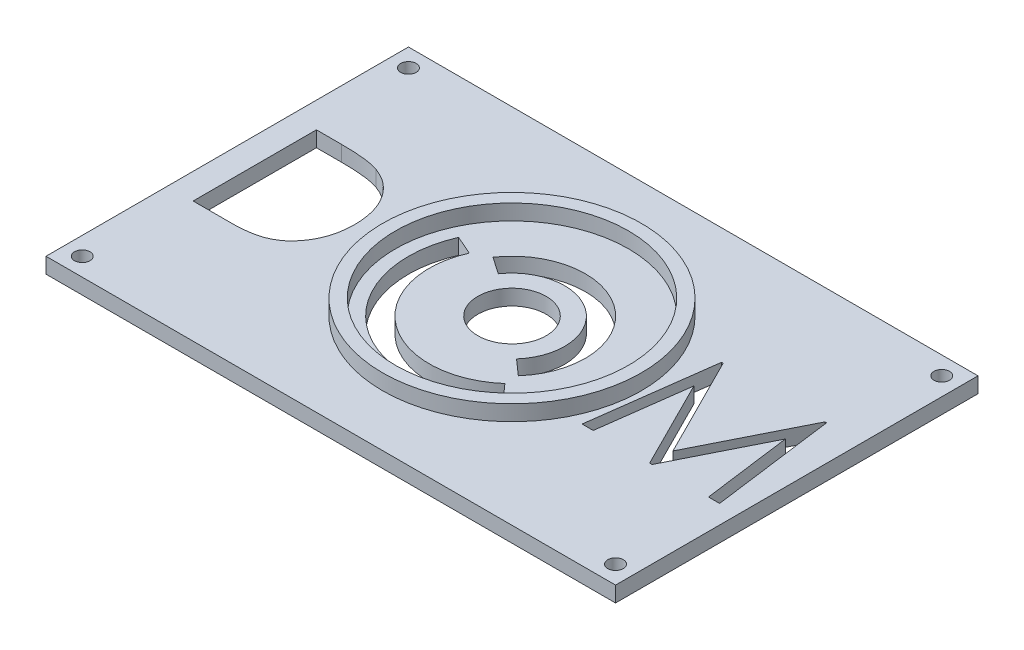
from build123d import *

# Parameters (mm, degrees)
SKETCH1_W           = 110
SKETCH1_H           = 70
BOSS_EXTRUDE1_DEPTH = 6
SKETCH2_R           = 22.5
CUT_EXTRUDE1_DEPTH  = 3
SKETCH3_R           = 6.6
CUT_EXTRUDE2_DEPTH  = 3.2
SKETCH4_W           = 110
SKETCH4_H           = 70
SKETCH4_R           = 25
CUT_EXTRUDE3_DEPTH  = 3
SKETCH5_R           = 1.5
CUT_EXTRUDE4_DEPTH  = 77.389408912
CUT_EXTRUDE5_DEPTH  = 5
CUT_EXTRUDE6_DEPTH  = 11.5


with BuildPart() as part:
    # Sketch1 → Boss-Extrude1 (new body)
    with BuildSketch(Plane(origin=(0, 0, 0), x_dir=(1, 0, 0), z_dir=(0, 1, 0))):
        with Locations((-4.959349593, 12.235772358)):
            Rectangle(SKETCH1_W, SKETCH1_H)
    extrude(amount=BOSS_EXTRUDE1_DEPTH)

    # Sketch2 → Cut-Extrude1 (cut)
    with BuildSketch(Plane(origin=(0, 6, 0), x_dir=(1, 0, 0), z_dir=(0, 1, 0))):
        with Locations(Location((-4.959349593, 12.235772358, 0), (0, 0, 270))):
            Circle(SKETCH2_R)
    extrude(amount=-CUT_EXTRUDE1_DEPTH, mode=Mode.SUBTRACT)

    # Sketch3 → Cut-Extrude2 (cut)
    with BuildSketch(Plane(origin=(0, 3, 0), x_dir=(1, 0, 0), z_dir=(0, 1, 0))):
        with Locations(Location((-4.959349593, 12.235772358, 0), (0, 0, 270))):
            Circle(SKETCH3_R)
    extrude(amount=-CUT_EXTRUDE2_DEPTH, mode=Mode.SUBTRACT)

    # Sketch4 → Cut-Extrude3 (cut)
    with BuildSketch(Plane(origin=(0, 6, 0), x_dir=(1, 0, 0), z_dir=(0, 1, 0))):
        with Locations((-4.959349593, 12.235772358)):
            Rectangle(SKETCH4_W, SKETCH4_H)
        with Locations(Location((-4.959349593, 12.235772358, 0), (0, 0, 270))):
            Circle(SKETCH4_R, mode=Mode.SUBTRACT)
    extrude(amount=-CUT_EXTRUDE3_DEPTH, mode=Mode.SUBTRACT)

    # Sketch5 → Cut-Extrude4 (cut, through all)
    with BuildSketch(Plane(origin=(0, 3, 0), x_dir=(1, 0, 0), z_dir=(0, 1, 0))):
        with Locations(Location((-56.459349593, 43.735772358, 0), (0, 0, 270))):
            Circle(SKETCH5_R)
        with Locations(Location((-56.459349593, -19.264227642, 0), (0, 0, 270))):
            Circle(SKETCH5_R)
        with Locations(Location((46.540650407, -19.264227642, 0), (0, 0, 270))):
            Circle(SKETCH5_R)
        with Locations(Location((46.540650407, 43.735772358, 0), (0, 0, 270))):
            Circle(SKETCH5_R)
    extrude(amount=-CUT_EXTRUDE4_DEPTH, mode=Mode.SUBTRACT)

    # Sketch6 → Cut-Extrude5 (cut)
    with BuildSketch(Plane(origin=(0, 3, 0), x_dir=(1, 0, 0), z_dir=(0, 1, 0))):
        with BuildLine():
            Line((-16.640340857, 20.239524173), (-13.34062581, 17.978577332))
            ThreePointArc((-13.34062581, 17.978577332), (1.290813758, 20.245832163), (2.648826126, 5.502180284))
            Line((2.648826126, 5.502180284), (5.644170898, 2.851159782))
            ThreePointArc((5.644170898, 2.851159782), (3.751507991, 23.399399015), (-16.640340857, 20.239524173))
        make_face()
        with BuildLine():
            Line((-23.2771021, 20.239524173), (-19.611718907, 18.637973034))
            ThreePointArc((-19.611718907, 18.637973034), (-14.365152691, -0.69523565), (5.644170898, 0.267253101))
            Line((5.644170898, 0.267253101), (8.296708857, -2.726747963))
            ThreePointArc((8.296708857, -2.726747963), (-16.718074041, -3.930009385), (-23.2771021, 20.239524173))
        make_face()
    extrude(amount=-CUT_EXTRUDE5_DEPTH, mode=Mode.SUBTRACT)

    # Sketch7 → Cut-Extrude6 (cut)
    # profile 1 of 2: a face of its own
    with BuildSketch(Plane(origin=(0, 3, 0), x_dir=(1, 0, 0), z_dir=(0, 1, 0))):
        with BuildLine():
            Line((-54.989769689, 0.681181381), (-54.989769689, 24.493681381))
            Line((-54.989769689, 24.493681381), (-50.18147642, 24.493681381))
            add(Edge.make_bspline(
                [(-50.18147642, 24.493681381), (-49.763267768, 24.490670325), (-48.955290829, 24.484852979), (-47.787713285, 24.447968157), (-46.707416615, 24.382718738), (-45.71795377, 24.287676069), (-44.816608381, 24.170974179), (-44.00590428, 24.024694643), (-43.281649522, 23.851964412), (-42.836223506, 23.704698045), (-42.625586997, 23.635057583)],
                knots=[0, 0, 0, 0, 1.314313732, 2.53924729, 3.670748893, 4.714932338, 5.66265055, 6.526160246, 7.303039223, 8, 8, 8, 8], degree=3))
            add(Edge.make_bspline(
                [(-42.625586997, 23.635057583), (-42.350078145, 23.530073675), (-41.805308069, 23.322486546), (-41.029652467, 22.930898138), (-40.299456694, 22.487216143), (-39.610805012, 21.99085572), (-38.979427961, 21.427762563), (-38.38065995, 20.82185632), (-37.838995489, 20.151103505), (-37.34295869, 19.429414748), (-36.895721435, 18.665291678), (-36.506971093, 17.860190313), (-36.18411446, 17.018199309), (-35.916099829, 16.141660177), (-35.704873038, 15.228645535), (-35.560760252, 14.278092268), (-35.465707625, 13.293757068), (-35.456155061, 12.625820092), (-35.451308151, 12.286913052)],
                knots=[0, 0, 0, 0, 0.984719456, 1.947108742, 2.898477687, 3.838006223, 4.779231079, 5.722358779, 6.681677486, 7.655904652, 8.64651281, 9.637519902, 10.640069247, 11.656948941, 12.698408672, 13.768548281, 14.867775369, 16, 16, 16, 16], degree=3))
            add(Edge.make_bspline(
                [(-35.451308151, 12.286913052), (-35.455587376, 11.992582126), (-35.464020036, 11.412572294), (-35.539739131, 10.557765486), (-35.64979588, 9.728317795), (-35.820185869, 8.928179015), (-36.027031541, 8.150338818), (-36.292126927, 7.403087299), (-36.595807714, 6.679569596), (-36.94993278, 5.989568554), (-37.338698275, 5.335858468), (-37.755905135, 4.719621392), (-38.201108366, 4.149650687), (-38.678553297, 3.624220308), (-39.182070082, 3.144122355), (-39.71495526, 2.705346322), (-40.278583873, 2.316477619), (-40.870431469, 1.962235329), (-41.507763705, 1.653214696), (-42.202652366, 1.391753379), (-42.958060916, 1.175082657), (-43.772135159, 0.994305669), (-44.646281677, 0.850904735), (-45.581357498, 0.754794815), (-46.575925951, 0.689800755), (-47.258863452, 0.684110293), (-47.610375158, 0.681181381)],
                knots=[0, 0, 0, 0, 1.105936401, 2.179363191, 3.223086493, 4.248585256, 5.251745608, 6.245858792, 7.225916811, 8.198733463, 9.158002045, 10.082870192, 10.993790845, 11.873723703, 12.748670949, 13.606408763, 14.465103618, 15.319838547, 16.196477973, 17.123216899, 18.106603292, 19.147568657, 20.255746949, 21.433717677, 22.679120308, 24, 24, 24, 24], degree=3))
            Line((-47.610375158, 0.681181381), (-54.989769689, 0.681181381))
        make_face()
        with BuildLine():
            Line((-52.852750458, 3.123489074), (-50.119464701, 3.123489074))
            add(Edge.make_bspline(
                [(-50.119464701, 3.123489074), (-49.726705607, 3.125177015), (-48.971286032, 3.128423544), (-47.885041444, 3.15691148), (-46.89254055, 3.203461091), (-45.993642423, 3.268605816), (-45.188854597, 3.354797645), (-44.476495156, 3.450897429), (-43.858899202, 3.570622943), (-43.485182854, 3.679146434), (-43.312486035, 3.729295864)],
                knots=[0, 0, 0, 0, 1.375205317, 2.645023457, 3.804390687, 4.853969522, 5.800190428, 6.637939096, 7.370582563, 8, 8, 8, 8], degree=3))
            add(Edge.make_bspline(
                [(-43.312486035, 3.729295864), (-43.095123072, 3.805846645), (-42.665588855, 3.957119791), (-42.0472729, 4.233056736), (-41.470622565, 4.559914389), (-40.925588286, 4.923240575), (-40.419901576, 5.335849981), (-39.947569642, 5.788770459), (-39.509543458, 6.284307053), (-39.110348613, 6.821844724), (-38.753104615, 7.398037798), (-38.443737858, 8.007221648), (-38.172605116, 8.642721554), (-37.959798977, 9.314296365), (-37.793005449, 10.01594228), (-37.674863555, 10.74770866), (-37.601284804, 11.509458845), (-37.592702453, 12.027565262), (-37.588327381, 12.291683184)],
                knots=[0, 0, 0, 0, 0.998632004, 1.973411704, 2.929992603, 3.868527914, 4.809262121, 5.754881198, 6.702106254, 7.672490631, 8.653608572, 9.636854334, 10.631411391, 11.644891563, 12.686317036, 13.754757253, 14.855430412, 16, 16, 16, 16], degree=3))
            add(Edge.make_bspline(
                [(-37.588327381, 12.291683184), (-37.591819569, 12.570177041), (-37.598680001, 13.117280688), (-37.684910578, 13.920038812), (-37.810923303, 14.692112523), (-37.993148024, 15.43355346), (-38.225359897, 16.145808141), (-38.515155584, 16.824937309), (-38.846262405, 17.478113292), (-39.240211893, 18.090260316), (-39.671664412, 18.669197362), (-40.150485341, 19.199569198), (-40.669067425, 19.682583991), (-41.221754525, 20.125763958), (-41.824123004, 20.511279324), (-42.461982936, 20.856129779), (-43.144691878, 21.148791469), (-43.61966754, 21.304449446), (-43.861051239, 21.383555179)],
                knots=[0, 0, 0, 0, 1.122418816, 2.205001699, 3.251619955, 4.274784885, 5.280384055, 6.268708349, 7.249350384, 8.229342522, 9.199999885, 10.157847722, 11.105861043, 12.055065948, 13.010012805, 13.98527497, 14.976112212, 16, 16, 16, 16], degree=3))
            add(Edge.make_bspline(
                [(-43.861051239, 21.383555179), (-44.06074386, 21.438775876), (-44.485345162, 21.556190228), (-45.17821723, 21.684269995), (-45.958009586, 21.79723989), (-46.828184338, 21.892884765), (-47.787749569, 21.961514576), (-48.837443267, 22.013026556), (-49.977719148, 22.047769895), (-50.768175316, 22.050142349), (-51.178434052, 22.051373689)],
                knots=[0, 0, 0, 0, 0.674548936, 1.434276114, 2.292660221, 3.240891867, 4.284742987, 5.42552168, 6.663806718, 8, 8, 8, 8], degree=3))
            Line((-51.178434052, 22.051373689), (-52.852750458, 22.051373689))
            Line((-52.852750458, 22.051373689), (-52.852750458, 3.123489074))
        make_face(mode=Mode.SUBTRACT)
    # profile 2 of 2: a face of its own
    with BuildSketch(Plane(origin=(0, 3, 0), x_dir=(1, 0, 0), z_dir=(0, 1, 0))):
        Polygon((19.872381176, 0.938358716), (23.015898303, 24.750858716), (23.321186765, 24.750858716), (33.152429253, 5.212397178), (42.95982108, 24.750858716), (43.269879673, 24.750858716), (46.43247733, 0.938358716), (44.285917834, 0.938358716), (42.005794637, 18.07267362), (33.410016392, 0.938358716), (32.928233039, 0.938358716), (24.299063868, 18.110834678), (22.023710803, 0.938358716), align=None)
    extrude(amount=-CUT_EXTRUDE6_DEPTH, mode=Mode.SUBTRACT)


with BuildPart() as cut_extrude6_kept_piece:
    # of the separate pieces the step leaves, the one the design keeps (cut_extrude6_pieces_kept)
    add(part.part.solids().sort_by_distance((-59.959349593, 0, -47.235772358))[0])


solid = cut_extrude6_kept_piece.part
